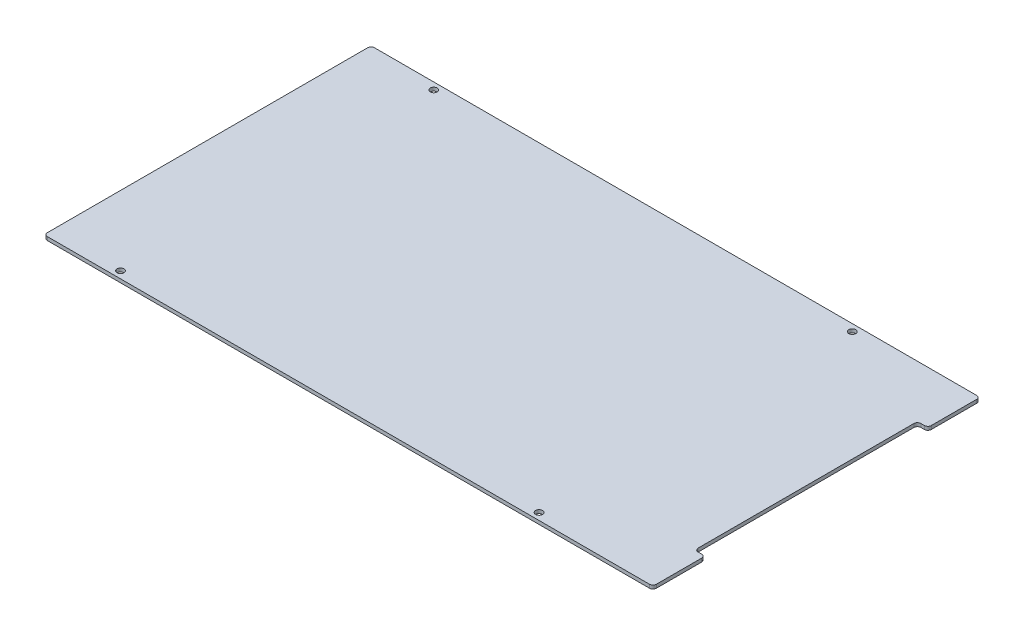
from build123d import *

# Parameters (mm, degrees)
SKETCH1_W                   = 555.625
SKETCH1_H                   = 298.45
BOSS_EXTRUDE1_DEPTH         = 3.175
SKETCH2_W                   = 9.525
SKETCH2_H                   = 203.2
CUT_EXTRUDE1_DEPTH          = 316.369571148
FILLET1_R                   = 3.175
F_1_4_0_25_DIAMETER_HOLE1_D = 6.35
FILLET2_R                   = 3.175


with BuildPart() as part:
    # Sketch1 → Boss-Extrude1 (new body)
    with BuildSketch(Plane(origin=(0, 0, 0), x_dir=(1, 0, 0), z_dir=(0, 1, 0))):
        Rectangle(SKETCH1_W, SKETCH1_H)
    extrude(amount=BOSS_EXTRUDE1_DEPTH)

    # Sketch2 → Cut-Extrude1 (cut, through all)
    with BuildSketch(Plane(origin=(0, 3.175, 0), x_dir=(1, 0, 0), z_dir=(0, 1, 0))):
        with Locations((273.05, 0)):
            Rectangle(SKETCH2_W, SKETCH2_H)
    extrude(amount=-CUT_EXTRUDE1_DEPTH, mode=Mode.SUBTRACT)

    # Fillet1
    fillet1_edges = [part.edges().sort_by_distance(p)[0] for p in [
        (268.2875, 1.5875, 101.6),
        (268.2875, 1.5875, -101.6),
    ]]
    fillet(fillet1_edges, radius=FILLET1_R)

    # 1/4 (0.25) Diameter Hole1 (through all)
    with Locations(Plane(origin=(0, 0, 0), x_dir=(-1, 0, 0), z_dir=(0, -1, 0))):
        with Locations((-167.5765, -142.875), (214.3125, -142.875)):
            f_1_4_0_25_diameter_hole1 = Hole(F_1_4_0_25_DIAMETER_HOLE1_D / 2)

    # Mirror1: 1/4 (0.25) Diameter Hole1 across plane
    add(f_1_4_0_25_diameter_hole1.mirror(Plane.XY), mode=Mode.SUBTRACT)

    # Fillet2
    fillet2_edges = [part.edges().sort_by_distance(p)[0] for p in [
        (277.8125, 1.5875, -101.6),
        (277.8125, 1.5875, 101.6),
        (277.8125, 1.5875, 149.225),
        (-277.8125, 1.5875, 149.225),
        (-277.8125, 1.5875, -149.225),
        (277.8125, 1.5875, -149.225),
    ]]
    fillet(fillet2_edges, radius=FILLET2_R)


solid = part.part
